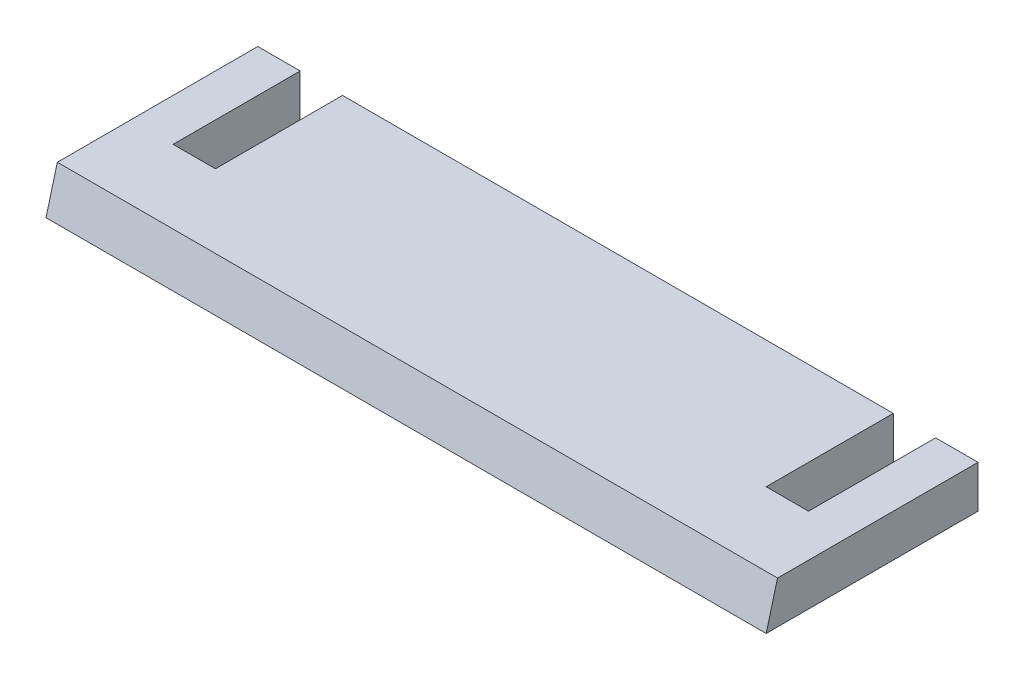
from build123d import *

# Parameters (mm, degrees)
BOSS_EXTRUDE1_DEPTH = 10
DRAFT2_ANGLE        = -15


with BuildPart() as part:
    # Sketch1 → Boss-Extrude1 (new body)
    with BuildSketch(Plane(origin=(0, 0, 0), x_dir=(1, 0, 0), z_dir=(0, 1, 0))):
        Polygon((-75, 25), (-75, -5), (-65, -5), (-65, 25), (65, 25), (65, -5), (75, -5), (75, 25), (85, 25), (85, -25), (-85, -25), (-85, 25), align=None)
    extrude(amount=BOSS_EXTRUDE1_DEPTH)

    # Draft2
    draft2_faces = [part.faces().sort_by_distance(p)[0] for p in [
        (0, 5, 25),
    ]]
    draft(draft2_faces, Plane(origin=(0, 0, 0), x_dir=(0, 0, -1), z_dir=(0, -1, 0)), DRAFT2_ANGLE)


solid = part.part
